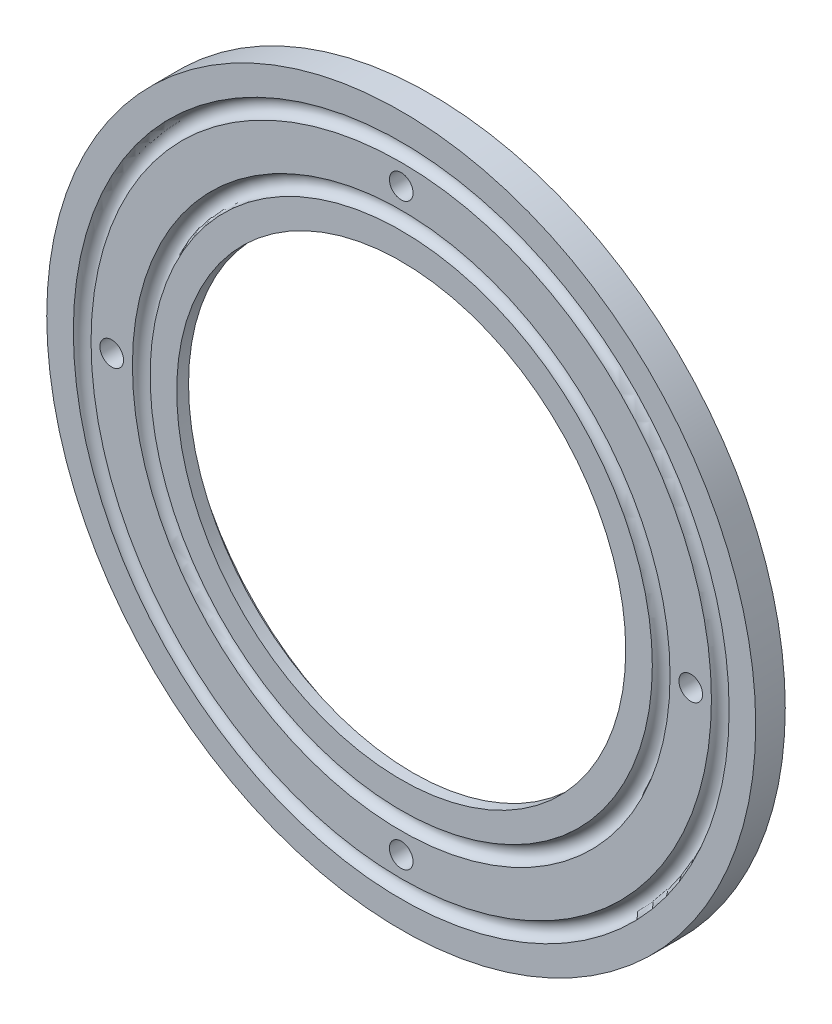
from build123d import *

# Parameters (mm, degrees)
SKETCH4_R          = 2
CUT_EXTRUDE1_DEPTH = 10
SKETCH5_R          = 42
CUT_EXTRUDE2_DEPTH = 3


with BuildPart() as part:
    # Sketch3 → Revolve1 (revolve)
    with BuildSketch(Plane(origin=(0, 0, 0), x_dir=(1, 0, 0), z_dir=(0, 1, 0))):
        with BuildLine():
            Line((60, 0), (60, 5))
            Line((60, 5), (38, 5))
            Line((38, 5), (38, 0))
            Line((38, 0), (42.5, 0))
            ThreePointArc((42.5, 0), (44, 1.5), (45.5, 0))
            Line((45.5, 0), (52.5, 0))
            ThreePointArc((52.5, 0), (54, 1.5), (55.5, 0))
            Line((55.5, 0), (60, 0))
        make_face()
    revolve(axis=Axis((0, 0, 0), (0, 0, -1)))

    # Sketch4 → Cut-Extrude1 (cut)
    with BuildSketch(Plane.XY):
        with Locations((49, 0)):
            Circle(SKETCH4_R)
        with Locations((-49, 0)):
            Circle(SKETCH4_R)
        with Locations((0, 49)):
            Circle(SKETCH4_R)
        with Locations((0, -49)):
            Circle(SKETCH4_R)
    extrude(amount=-CUT_EXTRUDE1_DEPTH, mode=Mode.SUBTRACT)

    # Sketch5 → Cut-Extrude2 (cut)
    with BuildSketch(Plane(origin=(0, 0, -5), x_dir=(-1, 0, 0), z_dir=(0, 0, -1))):
        Circle(SKETCH5_R)
    extrude(amount=-CUT_EXTRUDE2_DEPTH, mode=Mode.SUBTRACT)


solid = part.part
